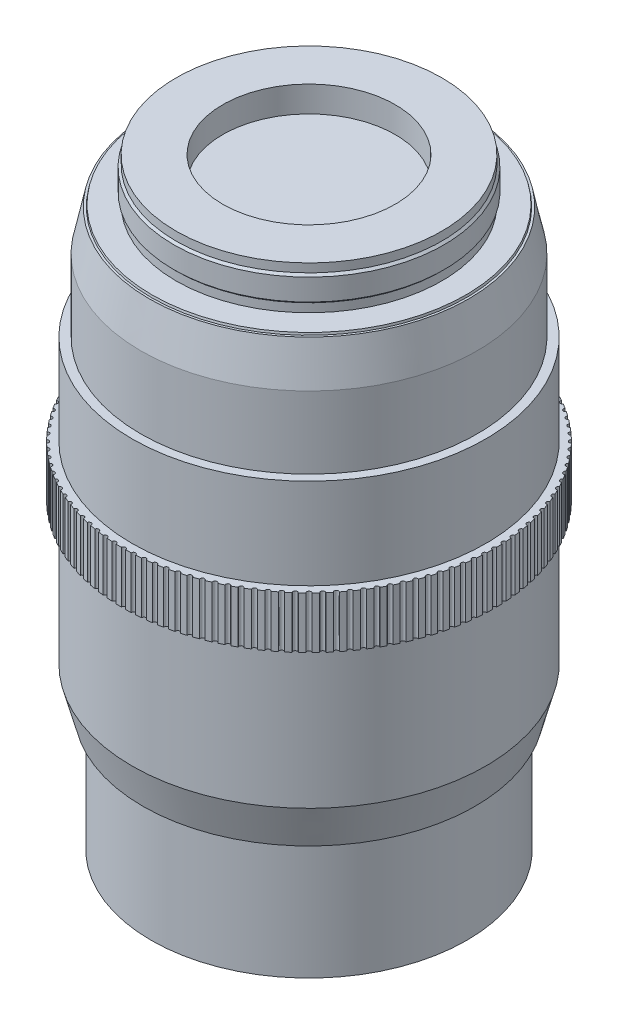
from build123d import *

# Parameters (mm, degrees)
SKETCH2_R          = 10
CUT_EXTRUDE1_DEPTH = 3
CUT_EXTRUDE2_DEPTH = 55.475131941
CIRPATTERN9_COUNT  = 120


with BuildPart() as part:
    # Sketch1 → Revolve1 (revolve)
    with BuildSketch(Plane(origin=(0, 0, 0), x_dir=(0, 0, -1), z_dir=(1, 0, 0))):
        Polygon((0, 0), (0, 75), (0, 80), (-15.4, 80), (-15.4, 79), (-15.65, 78.75), (-15.65, 76.25), (-15.4, 76), (-15.4, 75), (-18.19686086, 75), (-18.25, 74.75), (-18.5, 74.75), (-19.5, 70.045369891), (-19.5, 61.7), (-20.5, 61.7), (-20.5, 51.2), (-21.5, 51.2), (-21.5, 45.2), (-20.5, 45.2), (-20.5, 28.865063509), (-19.25, 24.2), (-18.3, 24.2), (-18.3, 10.27282252), (-16.767850657, 9.2), (-16.017850657, 9.2), (-16.017850657, 8.7), (-8.948518024, 3.75), (-8.698518024, 3.75), (-8.698518024, 3.5), (-3.7, 0), align=None)
    revolve(axis=Axis((0, 87.5, 0), (0, -1, 0)))

    # Sketch2 → Cut-Extrude1 (cut)
    with BuildSketch(Plane(origin=(0, 80, 0), x_dir=(1, 0, 0), z_dir=(0, 1, 0))):
        Circle(SKETCH2_R)
    extrude(amount=-CUT_EXTRUDE1_DEPTH, mode=Mode.SUBTRACT)

    # Sketch5 → Cut-Extrude2 (cut, symmetric)
    with BuildSketch(Plane(origin=(0, 45.2, 0), x_dir=(-1, 0, 0), z_dir=(0, -1, 0))):
        with BuildLine():
            Line((-0.868443272, -127.869718303), (-0.249995775, -21.498546512))
            ThreePointArc((-0.249995775, -21.498546512), (0, -21.25), (0.249995775, -21.498546512))
            Line((0.249995775, -21.498546512), (0.868443272, -127.869718303))
            Line((0.868443272, -127.869718303), (0.868443272, -340.615657542))
            Line((0.868443272, -340.615657542), (-0.868443272, -340.615657542))
            Line((-0.868443272, -340.615657542), (-0.868443272, -127.869718303))
        make_face()
    cut_extrude2 = extrude(amount=CUT_EXTRUDE2_DEPTH, both=True, mode=Mode.SUBTRACT)

    # CirPattern9: Cut-Extrude2 ×120 about axis
    cirpattern9_axis = Axis((0, 87.5, 0), (0, 1, 0))
    for i in range(1, CIRPATTERN9_COUNT):
        add(cut_extrude2.rotate(cirpattern9_axis, i * 360 / CIRPATTERN9_COUNT), mode=Mode.SUBTRACT)


solid = part.part
